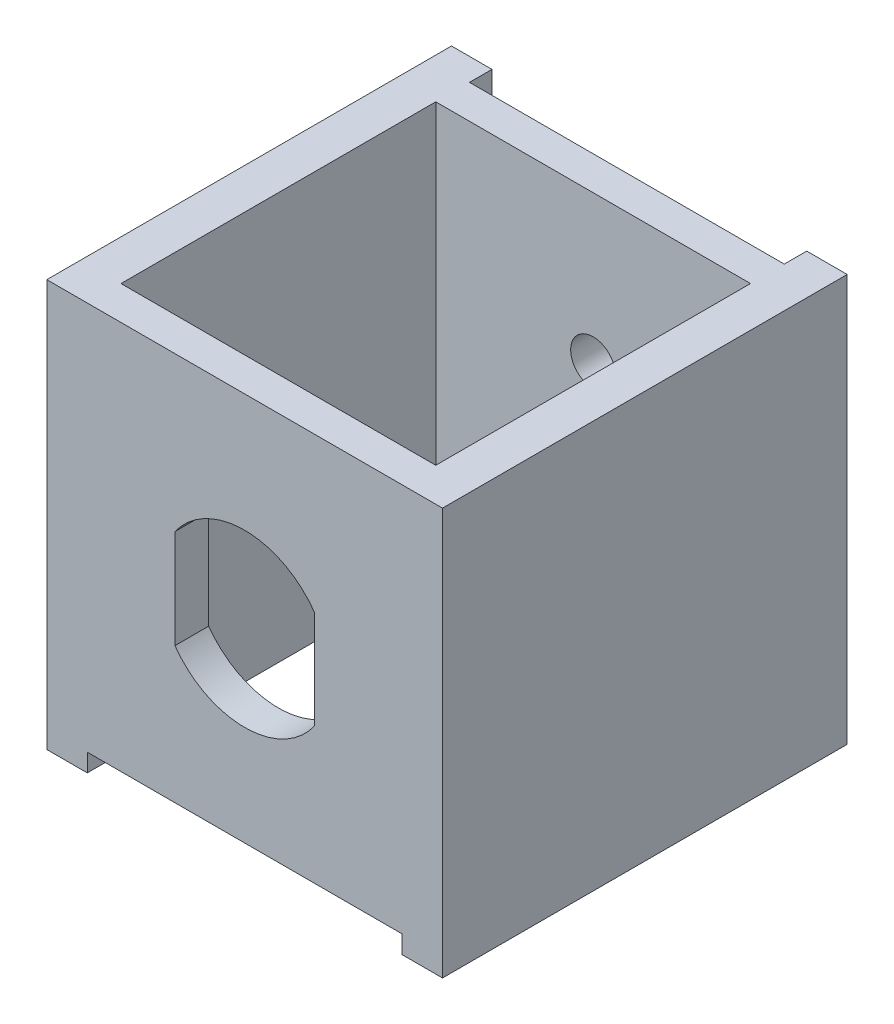
from build123d import *

# Parameters (mm, degrees)
SKETCH_1_W                  = 18
SKETCH_1_H                  = 18.5
EXTRUDE_1_DEPTH             = 1.5
SKETCH_2_W                  = 2
SKETCH_2_H                  = 18.5
EXTRUDE_2_DEPTH             = 18
SKETCH_5_W                  = 18
SKETCH_5_H                  = 1.5
EXTRUDE_5_DEPTH             = 15
SKETCH_6_R                  = 1
CUT_EXTRUDE_1_DEPTH         = 21.169593452
SKETCH_7_W                  = 14
SKETCH_7_H                  = 1.5
CUT_EXTRUDE_2_DEPTH         = 1
SKETCH_8_W                  = 27.6
SKETCH_8_H                  = 28.1
SKETCH_8_W_2                = 17.6
SKETCH_8_H_2                = 18.1
CUT_EXTRUDE_3_DEPTH         = 23.148645557
SKETCH_4_W                  = 5
SKETCH_4_H                  = 3
EXTRUDE_4_DEPTH             = 1.5
EXTRUDE_4_DIRECTION_2_REACH = 28.884
FILLET_1_R                  = 0.4


with BuildPart() as part:
    # Эскиз1 → Бобышка-Вытянуть1 (new body)
    with BuildSketch(Plane.XY):
        Rectangle(SKETCH_1_W, SKETCH_1_H)
        with BuildLine():
            Line((3.1, -2.197726098), (3.1, 2.197726098))
            ThreePointArc((3.1, 2.197726098), (0, 3.8), (-3.1, 2.197726098))
            Line((-3.1, 2.197726098), (-3.1, -2.197726098))
            ThreePointArc((-3.1, -2.197726098), (0, -3.8), (3.1, -2.197726098))
        make_face(mode=Mode.SUBTRACT)
    extrude(amount=-EXTRUDE_1_DEPTH)

    # Эскиз2 → Бобышка-Вытянуть2 (add)
    with BuildSketch(Plane.XY):
        with Locations((-8, 0)):
            Rectangle(SKETCH_2_W, SKETCH_2_H)
        with Locations((8, 0)):
            Rectangle(SKETCH_2_W, SKETCH_2_H)
    extrude(amount=-EXTRUDE_2_DEPTH)

    # Эскиз5 → Бобышка-Вытянуть5 (add)
    with BuildSketch(Plane(origin=(0, 9.25, 0), x_dir=(1, 0, 0), z_dir=(0, 1, 0))):
        with Locations((0, 16.25)):
            Rectangle(SKETCH_5_W, SKETCH_5_H)
    extrude(amount=-EXTRUDE_5_DEPTH)

    # Эскиз6 → Вырез-Вытянуть1 (cut, through all)
    with BuildSketch(Plane(origin=(0, 0, -15.5), x_dir=(-1, 0, 0), z_dir=(0, 0, -1))):
        with Locations((0, 2.5)):
            Circle(SKETCH_6_R)
        with Locations((0, -2.5)):
            Circle(SKETCH_6_R)
    extrude(amount=CUT_EXTRUDE_1_DEPTH, mode=Mode.SUBTRACT)

    # Эскиз7 → Вырез-Вытянуть2 (cut)
    with BuildSketch(Plane.XZ.offset(9.25)):
        with Locations((0, -0.75)):
            Rectangle(SKETCH_7_W, SKETCH_7_H)
    extrude(amount=-CUT_EXTRUDE_2_DEPTH, mode=Mode.SUBTRACT)

    # Эскиз8 → Вырез-Вытянуть3 (cut, through all)
    with BuildSketch(Plane.XY):
        Rectangle(SKETCH_8_W, SKETCH_8_H)
        Rectangle(SKETCH_8_W_2, SKETCH_8_H_2, mode=Mode.SUBTRACT)
    extrude(amount=-CUT_EXTRUDE_3_DEPTH, mode=Mode.SUBTRACT)

    # Эскиз4 → Бобышка-Вытянуть4 (add)
    with BuildSketch(Plane.ZY.offset(9)):
        with Locations((-9, 0)):
            Rectangle(SKETCH_4_W, SKETCH_4_H)
    extrude(amount=EXTRUDE_4_DEPTH)

    # Эскиз4 → Бобышка-Вытянуть4 direction 2 (add, up to next)
    with BuildSketch(Plane.ZY.offset(9), mode=Mode.PRIVATE) as extrude_4_direction_2_sk1:
        with Locations((-9, 0)):
            Rectangle(SKETCH_4_W, SKETCH_4_H)
    extrude_4_direction_2_tool1 = extrude(extrude_4_direction_2_sk1.sketch, amount=-EXTRUDE_4_DIRECTION_2_REACH, mode=Mode.PRIVATE) - part.part
    add(extrude_4_direction_2_tool1.solids().sort_by_distance((-9, 0, -9))[0])

    # Скругление1
    fillet_1_edges = [part.edges().sort_by_distance(p)[0] for p in [
        (-10.5, 0, -6.5),
        (-10.5, 0, -11.5),
    ]]
    fillet(fillet_1_edges, radius=FILLET_1_R)


solid = part.part
